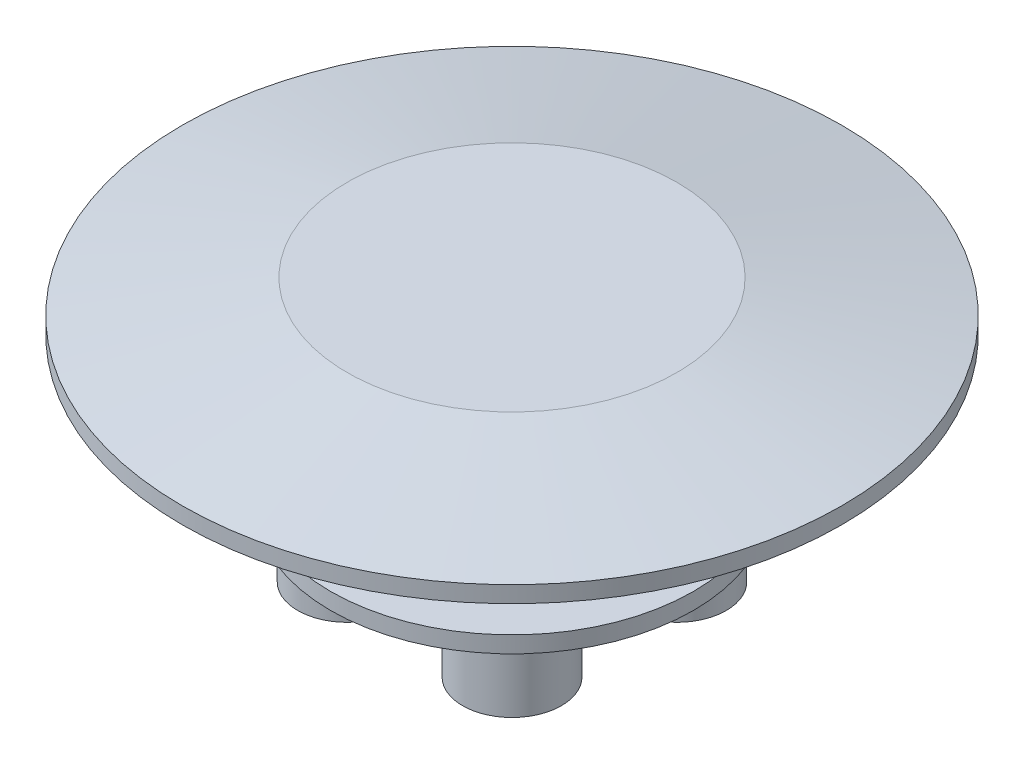
from build123d import *

# Parameters (mm, degrees)
SKETCH1_R           = 100
BOSS_EXTRUDE1_DEPTH = 5
SKETCH2_R           = 50
BOSS_EXTRUDE2_DEPTH = 5
SKETCH3_R           = 10
SKETCH3_R_2         = 5
BOSS_EXTRUDE3_DEPTH = 5
SKETCH5_R           = 22.5
BOSS_EXTRUDE4_DEPTH = 40
SKETCH6_R           = 55
BOSS_EXTRUDE5_DEPTH = 5
SKETCH7_R           = 15
BOSS_EXTRUDE6_DEPTH = 20
SKETCH9_R           = 2.5
CUT_EXTRUDE2_DEPTH  = 5
SKETCH11_R          = 10
CUT_EXTRUDE3_DEPTH  = 1


with BuildPart() as part:
    # Sketch1 → Boss-Extrude1 (new body)
    with BuildSketch(Plane(origin=(0, 0, 0), x_dir=(1, 0, 0), z_dir=(0, 1, 0))):
        with Locations(Location((0, 0, 0), (0, 0, 270))):
            Circle(SKETCH1_R)
    extrude(amount=BOSS_EXTRUDE1_DEPTH)



with BuildPart() as body_2:
    # Sketch2 → Boss-Extrude2 (new body)
    with BuildSketch(Plane(origin=(0, 15, 0), x_dir=(-1, 0, 0), z_dir=(0, -1, 0))):
        with Locations(Location((0, 0, 0), (0, 0, 90))):
            Circle(SKETCH2_R)
    extrude(amount=BOSS_EXTRUDE2_DEPTH)


with BuildPart() as part_1:
    add(part.part)

    add(body_2.part)  # Boss-Extrude3 merges body 2
    # Sketch3 → Boss-Extrude3 (add)
    with BuildSketch(Plane(origin=(0, 5, 0), x_dir=(1, 0, 0), z_dir=(0, 1, 0))):
        with Locations(Location((0, 0, 0), (0, 0, 90))):
            Circle(SKETCH3_R)
        with Locations(Location((0, 0, 0), (0, 0, 90))):
            Circle(SKETCH3_R_2, mode=Mode.SUBTRACT)
    extrude(amount=BOSS_EXTRUDE3_DEPTH)

    # Sketch4 → Revolve1 (revolve)
    with BuildSketch(Plane.XY, mode=Mode.PRIVATE) as revolve1_sk:
        Polygon((50, 15), (100, 5), (0, 5), (0, 10), (50, 10), align=None)
    revolve(revolve1_sk.sketch.rotate(Axis((0, 54.07219912, 0), (0, -1, 0)), 270), axis=Axis((0, 54.07219912, 0), (0, -1, 0)))

    # Sketch5 → Boss-Extrude4 (add)
    with BuildSketch(Plane.XZ):
        with Locations(Location((0, 0, 0), (0, 0, 270))):
            Circle(SKETCH5_R)
    extrude(amount=BOSS_EXTRUDE4_DEPTH)

    # Sketch6 → Boss-Extrude5 (add)
    with BuildSketch(Plane.XZ.offset(40)):
        with Locations(Location((0, 0, 0), (0, 0, 270))):
            Circle(SKETCH6_R)
    extrude(amount=BOSS_EXTRUDE5_DEPTH)

    # Sketch7 → Boss-Extrude6 (add)
    with BuildSketch(Plane.XZ.offset(45)):
        with Locations(Location((-25, -25, 0), (0, 0, 270))):
            Circle(SKETCH7_R)
        with Locations(Location((25, -25, 0), (0, 0, 270))):
            Circle(SKETCH7_R)
        with Locations(Location((25, 25, 0), (0, 0, 270))):
            Circle(SKETCH7_R)
        with Locations(Location((-25, 25, 0), (0, 0, 270))):
            Circle(SKETCH7_R)
    extrude(amount=BOSS_EXTRUDE6_DEPTH)

    # Sketch9 → Cut-Extrude2 (cut)
    with BuildSketch(Plane.XZ.offset(45)):
        with Locations(Location((0, 40, 0), (0, 0, 270))):
            Circle(SKETCH9_R)
        with Locations(Location((40, 0, 0), (0, 0, 270))):
            Circle(SKETCH9_R)
        with Locations(Location((0, -40, 0), (0, 0, 270))):
            Circle(SKETCH9_R)
        with Locations(Location((-40, 0, 0), (0, 0, 270))):
            Circle(SKETCH9_R)
    extrude(amount=-CUT_EXTRUDE2_DEPTH, mode=Mode.SUBTRACT)

    # Sketch11 → Cut-Extrude3 (cut)
    with BuildSketch(Plane(origin=(0, -40, 0), x_dir=(1, 0, 0), z_dir=(0, 1, 0))):
        with Locations(Location((0, 40, 0), (0, 0, 270))):
            Circle(SKETCH11_R)
        with Locations(Location((40, 0, 0), (0, 0, 270))):
            Circle(SKETCH11_R)
        with Locations(Location((0, -40, 0), (0, 0, 270))):
            Circle(SKETCH11_R)
        with Locations(Location((-40, 0, 0), (0, 0, 270))):
            Circle(SKETCH11_R)
    extrude(amount=-CUT_EXTRUDE3_DEPTH, mode=Mode.SUBTRACT)


solid = part_1.part
